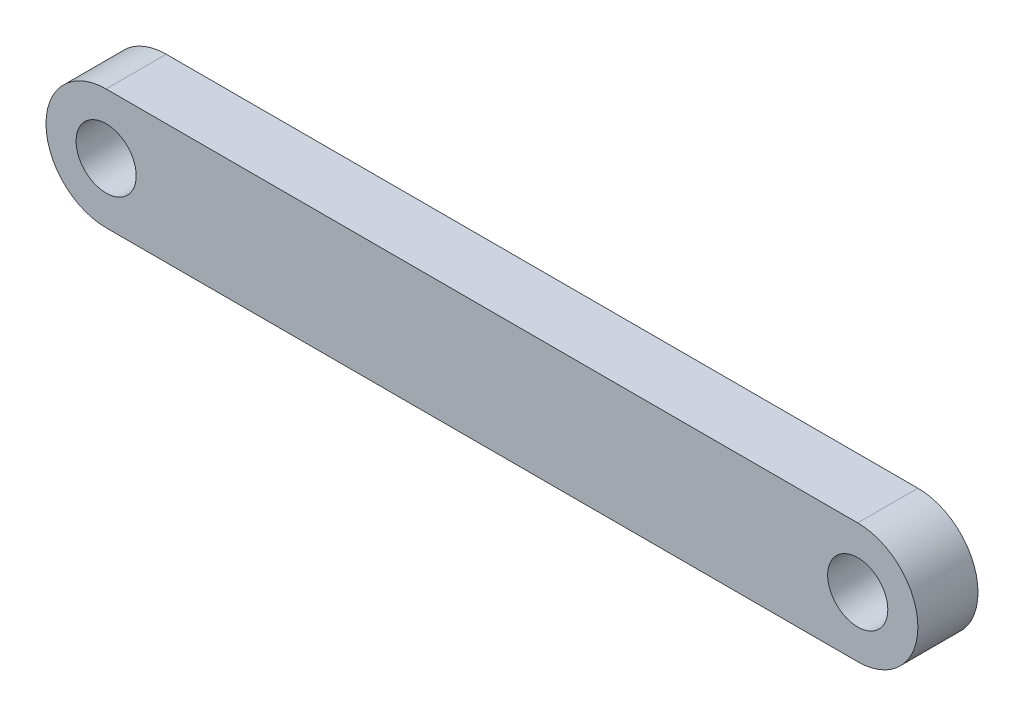
from build123d import *

# Parameters (mm, degrees)
SKETCH1_R           = 5
BOSS_EXTRUDE3_DEPTH = 5


with BuildPart() as part:
    # Sketch1 → Boss-Extrude3 (new, symmetric)
    with BuildSketch(Plane.XY):
        with BuildLine():
            Line((-62.5, 10), (62.5, 10))
            ThreePointArc((62.5, 10), (72.5, 0), (62.5, -10))
            Line((62.5, -10), (-62.5, -10))
            ThreePointArc((-62.5, -10), (-72.5, 0), (-62.5, 10))
        make_face()
        with Locations((-62.5, 0)):
            Circle(SKETCH1_R, mode=Mode.SUBTRACT)
        with Locations((62.5, 0)):
            Circle(SKETCH1_R, mode=Mode.SUBTRACT)
    extrude(amount=BOSS_EXTRUDE3_DEPTH, both=True)


solid = part.part
